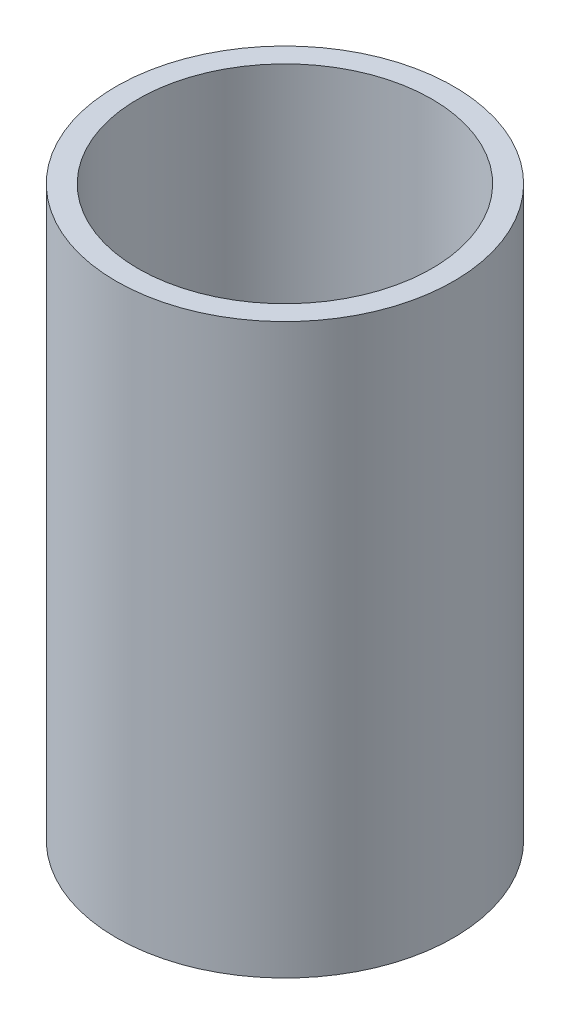
from build123d import *

# Parameters (mm, degrees)
SKETCH1_R   = 30.1625
SKETCH1_R_2 = 26.2509


with BuildPart() as part:
    # Sweep1: sweep along a path in Sketch2
    with BuildLine(Plane(origin=(0, 0, 0), x_dir=(0, 0, -1), z_dir=(1, 0, 0))) as sweep1_path:
        Line((0, 0), (0, 101.6))
    # Sketch1 → Sweep1 (sweep)
    with BuildSketch(Plane(origin=(0, 0, 0), x_dir=(1, 0, 0), z_dir=(0, 1, 0))):
        Circle(SKETCH1_R)
        Circle(SKETCH1_R_2, mode=Mode.SUBTRACT)
    sweep(path=sweep1_path.line)


solid = part.part
